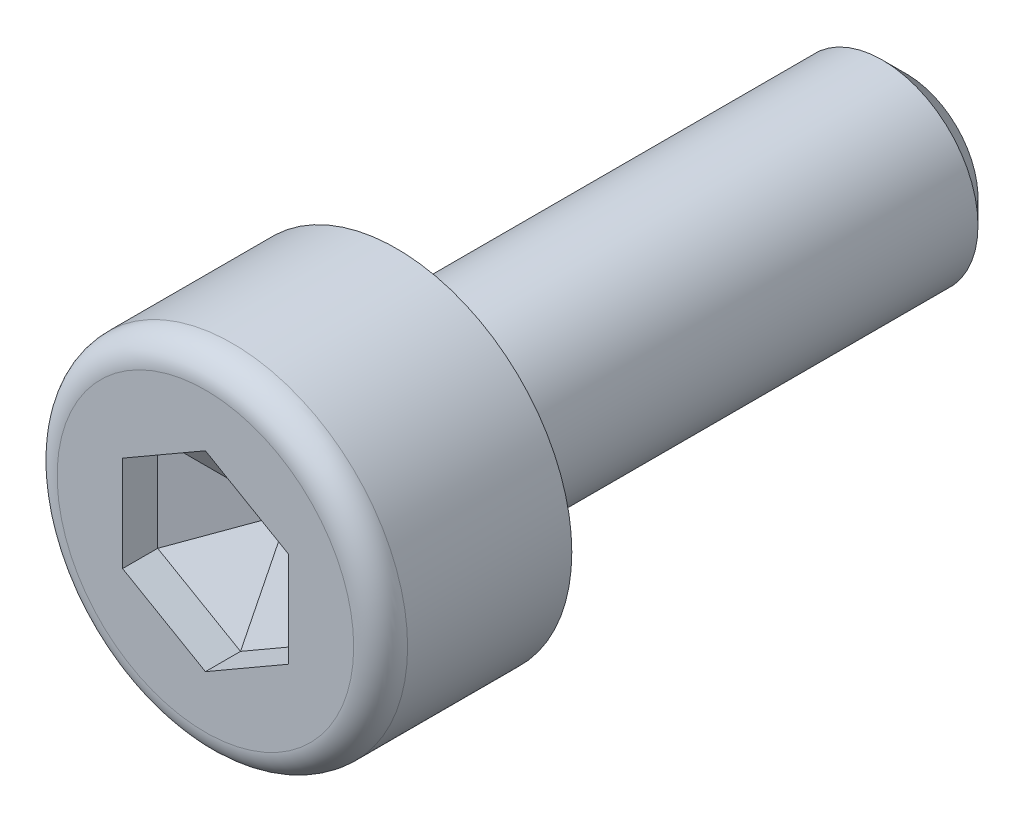
from build123d import *
from OCP.BRepFilletAPI import BRepFilletAPI_MakeChamfer

# Parameters (mm, degrees)
SKETCH_1_R          = 2.75
EXTRUDE_1_DEPTH     = 3
CUT_EXTRUDE_1_DEPTH = 1.3
SKETCH_3_R          = 1.5
EXTRUDE_2_DEPTH     = 8
CHAMFER_1_SIZE      = 0.375
FILLET_1_R          = 0.423076923
CHAMFER_2_SIZE      = 0.749279539
CHAMFER_2_SIZE2     = 1.29779023
FILLET_2_R          = 0.1


with BuildPart() as part:
    # 草图1 → 凸台-拉伸1 (new body)
    with BuildSketch(Plane.XY):
        Circle(SKETCH_1_R)
    extrude(amount=EXTRUDE_1_DEPTH)

    # 草图2 → 切除-拉伸1 (cut)
    with BuildSketch(Plane.XY.offset(3)):
        Polygon((1.3, 0.75055535), (0, 1.5011107), (-1.3, 0.75055535), (-1.3, -0.75055535), (0, -1.5011107), (1.3, -0.75055535), align=None)
    extrude(amount=-CUT_EXTRUDE_1_DEPTH, mode=Mode.SUBTRACT)

    # 草图3 → 凸台-拉伸2 (add)
    with BuildSketch(Plane(origin=(0, 0, 0), x_dir=(-1, 0, 0), z_dir=(0, 0, -1))):
        Circle(SKETCH_3_R)
    extrude(amount=EXTRUDE_2_DEPTH)

    # 倒角1
    chamfer_1_edges = [part.edges().sort_by_distance(p)[0] for p in [
        (1.5, 0, -8),
    ]]
    chamfer(chamfer_1_edges, length=CHAMFER_1_SIZE)

    # 圆角1
    fillet_1_edges = [part.edges().sort_by_distance(p)[0] for p in [
        (-2.75, 0, 3),
    ]]
    fillet(fillet_1_edges, radius=FILLET_1_R)

    # 倒角2: one chamfer whose edges measure the first distance from different faces: ONE call of the kernel's chamfer builder (chamfer() names one face for all edges)
    chamfer_2_edges_1 = [part.edges().sort_by_distance(p)[0] for p in [
        (-1.3, 0, 1.7),
    ]]
    chamfer_2_side_1 = [part.faces().sort_by_distance(p)[0] for p in [
        (-1.3, 0, 2.35),
    ]]
    chamfer_2_edges_2 = [part.edges().sort_by_distance(p)[0] for p in [
        (-0.65, 1.125833025, 1.7),
    ]]
    chamfer_2_side_2 = [part.faces().sort_by_distance(p)[0] for p in [
        (-0.65, 1.125833025, 2.35),
    ]]
    chamfer_2_edges_3 = [part.edges().sort_by_distance(p)[0] for p in [
        (0.65, 1.125833025, 1.7),
    ]]
    chamfer_2_side_3 = [part.faces().sort_by_distance(p)[0] for p in [
        (0.65, 1.125833025, 2.35),
    ]]
    chamfer_2_edges_4 = [part.edges().sort_by_distance(p)[0] for p in [
        (1.3, 0, 1.7),
    ]]
    chamfer_2_side_4 = [part.faces().sort_by_distance(p)[0] for p in [
        (1.3, 0, 2.35),
    ]]
    chamfer_2_edges_5 = [part.edges().sort_by_distance(p)[0] for p in [
        (-0.65, -1.125833025, 1.7),
    ]]
    chamfer_2_side_5 = [part.faces().sort_by_distance(p)[0] for p in [
        (-0.65, -1.125833025, 2.35),
    ]]
    chamfer_2_edges_6 = [part.edges().sort_by_distance(p)[0] for p in [
        (0.65, -1.125833025, 1.7),
    ]]
    chamfer_2_side_6 = [part.faces().sort_by_distance(p)[0] for p in [
        (0.65, -1.125833025, 2.35),
    ]]
    chamfer_2 = BRepFilletAPI_MakeChamfer(part.part.solid().wrapped)
    for e in chamfer_2_edges_1:
        chamfer_2.Add(CHAMFER_2_SIZE, CHAMFER_2_SIZE2, e.wrapped, chamfer_2_side_1[0].wrapped)  # the first distance lies on this face
    for e in chamfer_2_edges_2:
        chamfer_2.Add(CHAMFER_2_SIZE, CHAMFER_2_SIZE2, e.wrapped, chamfer_2_side_2[0].wrapped)  # the first distance lies on this face
    for e in chamfer_2_edges_3:
        chamfer_2.Add(CHAMFER_2_SIZE, CHAMFER_2_SIZE2, e.wrapped, chamfer_2_side_3[0].wrapped)  # the first distance lies on this face
    for e in chamfer_2_edges_4:
        chamfer_2.Add(CHAMFER_2_SIZE, CHAMFER_2_SIZE2, e.wrapped, chamfer_2_side_4[0].wrapped)  # the first distance lies on this face
    for e in chamfer_2_edges_5:
        chamfer_2.Add(CHAMFER_2_SIZE, CHAMFER_2_SIZE2, e.wrapped, chamfer_2_side_5[0].wrapped)  # the first distance lies on this face
    for e in chamfer_2_edges_6:
        chamfer_2.Add(CHAMFER_2_SIZE, CHAMFER_2_SIZE2, e.wrapped, chamfer_2_side_6[0].wrapped)  # the first distance lies on this face
    add(Compound.cast(chamfer_2.Shape()), mode=Mode.REPLACE)

    # 圆角2
    fillet_2_edges = [part.edges().sort_by_distance(p)[0] for p in [
        (1.5, 0, 0),
    ]]
    fillet(fillet_2_edges, radius=FILLET_2_R)


solid = part.part
